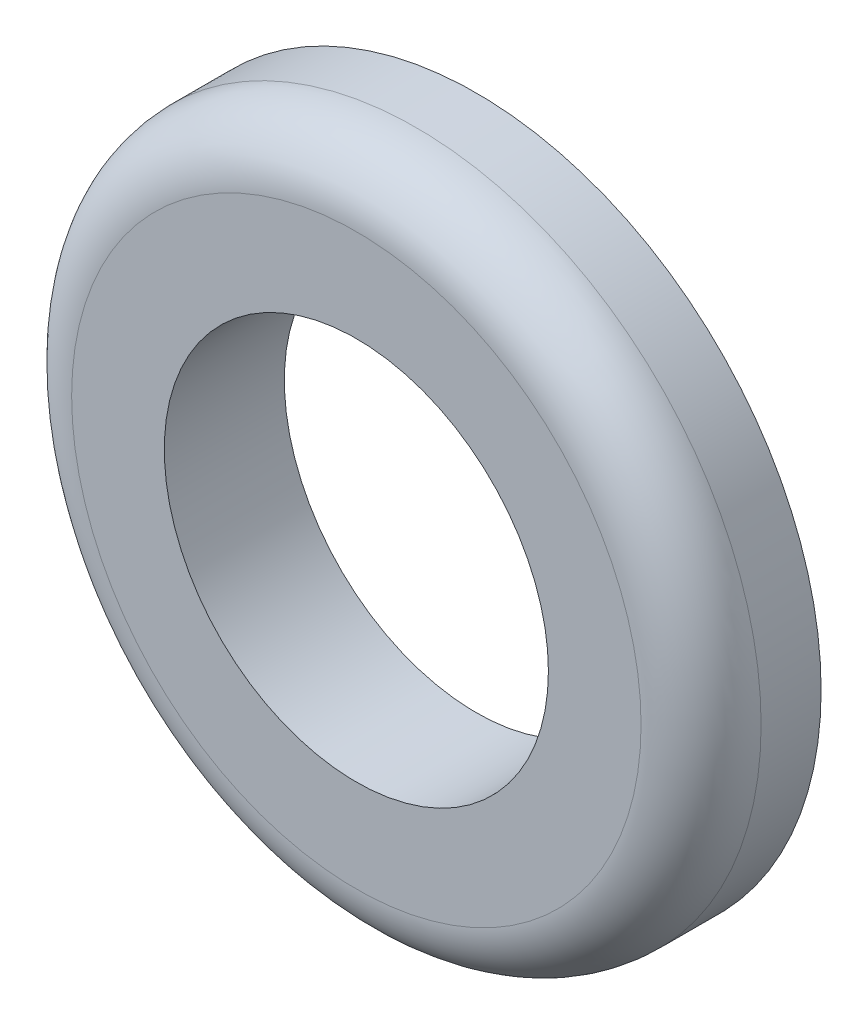
from build123d import *

# Parameters (mm, degrees)
ESQUISSE1_R        = 2.871794872
ESQUISSE1_R_2      = 1.6
BOSS_EXTRU_1_DEPTH = 1
CONG_1_R           = 0.5


with BuildPart() as part:
    # Esquisse1 → Boss.-Extru.1 (new body)
    with BuildSketch(Plane.XY):
        Circle(ESQUISSE1_R)
        Circle(ESQUISSE1_R_2, mode=Mode.SUBTRACT)
    extrude(amount=BOSS_EXTRU_1_DEPTH)

    # Congé1
    cong_1_edges = [part.edges().sort_by_distance(p)[0] for p in [
        (-2.871794872, 0, 1),
    ]]
    fillet(cong_1_edges, radius=CONG_1_R)


solid = part.part
